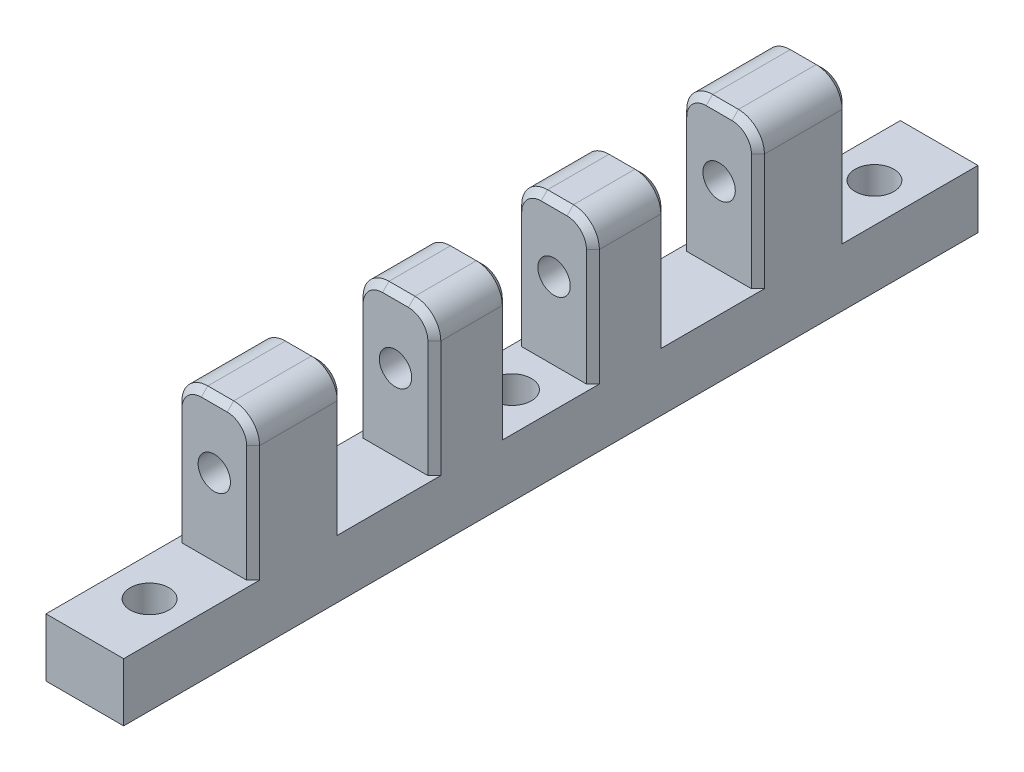
from build123d import *

# Parameters (mm, degrees)
SKETCH_1_W          = 66
SKETCH_1_H          = 4.5
EXTRUDE_1_DEPTH     = 6
SKETCH_2_W          = 5.75
SKETCH_2_H          = 11
SKETCH_2_W_2        = 7
EXTRUDE_2_DEPTH     = 6
SKETCH_3_R          = 1.25
CUT_EXTRUDE_1_DEPTH = 51
SKETCH_4_R          = 1.5
CUT_EXTRUDE_2_DEPTH = 51
FILLET_1_R          = 2
FILLET_2_R          = 2
FILLET_3_R          = 2
FILLET_4_R          = 2
FILLET_5_R          = 2
FILLET_6_R          = 2
FILLET_7_R          = 2
FILLET_8_R          = 2
CHAMFER_1_SIZE      = 0.5
CHAMFER_2_SIZE      = 0.5


with BuildPart() as part:
    # 草图1 → 凸台-拉伸1 (new body)
    with BuildSketch(Plane(origin=(0, 0, 0), x_dir=(0, 0, -1), z_dir=(1, 0, 0))):
        Rectangle(SKETCH_1_W, SKETCH_1_H)
    extrude(amount=EXTRUDE_1_DEPTH)

    # 草图2 → 凸台-拉伸2 (add)
    with BuildSketch(Plane.ZY):
        with Locations((6.125, 7.75)):
            Rectangle(SKETCH_2_W, SKETCH_2_H)
        with Locations((19.5, 7.75)):
            Rectangle(SKETCH_2_W_2, SKETCH_2_H)
        with Locations((-19.5, 7.75)):
            Rectangle(SKETCH_2_W_2, SKETCH_2_H)
        with Locations((-6.125, 7.75)):
            Rectangle(SKETCH_2_W, SKETCH_2_H)
    extrude(amount=-EXTRUDE_2_DEPTH)

    # 草图3 → 切除-拉伸1 (cut)
    with BuildSketch(Plane.XY.offset(23)):
        with Locations((3, 8.182)):
            Circle(SKETCH_3_R)
    extrude(amount=-CUT_EXTRUDE_1_DEPTH, mode=Mode.SUBTRACT)

    # 草图4 → 切除-拉伸2 (cut)
    with BuildSketch(Plane(origin=(0, 2.25, 0), x_dir=(1, 0, 0), z_dir=(0, 1, 0))):
        with Locations(Location((3, 0, 0), (0, 0, 270))):
            Circle(SKETCH_4_R)
        with Locations(Location((3, 28, 0), (0, 0, 270))):
            Circle(SKETCH_4_R)
        with Locations(Location((3, -28, 0), (0, 0, 270))):
            Circle(SKETCH_4_R)
    extrude(amount=-CUT_EXTRUDE_2_DEPTH, mode=Mode.SUBTRACT)

    # 圆角1
    fillet_1_edges = [part.edges().sort_by_distance(p)[0] for p in [
        (6, 13.25, 19.5),
    ]]
    fillet(fillet_1_edges, radius=FILLET_1_R)

    # 圆角2
    fillet_2_edges = [part.edges().sort_by_distance(p)[0] for p in [
        (6, 13.25, -19.5),
    ]]
    fillet(fillet_2_edges, radius=FILLET_2_R)

    # 圆角3
    fillet_3_edges = [part.edges().sort_by_distance(p)[0] for p in [
        (6, 13.25, 6.125),
    ]]
    fillet(fillet_3_edges, radius=FILLET_3_R)

    # 圆角4
    fillet_4_edges = [part.edges().sort_by_distance(p)[0] for p in [
        (6, 13.25, -6.125),
    ]]
    fillet(fillet_4_edges, radius=FILLET_4_R)

    # 圆角5
    fillet_5_edges = [part.edges().sort_by_distance(p)[0] for p in [
        (0, 13.25, -19.5),
    ]]
    fillet(fillet_5_edges, radius=FILLET_5_R)

    # 圆角6
    fillet_6_edges = [part.edges().sort_by_distance(p)[0] for p in [
        (0, 13.25, -6.125),
    ]]
    fillet(fillet_6_edges, radius=FILLET_6_R)

    # 圆角7
    fillet_7_edges = [part.edges().sort_by_distance(p)[0] for p in [
        (0, 13.25, 6.125),
    ]]
    fillet(fillet_7_edges, radius=FILLET_7_R)

    # 圆角8
    fillet_8_edges = [part.edges().sort_by_distance(p)[0] for p in [
        (0, 13.25, 19.5),
    ]]
    fillet(fillet_8_edges, radius=FILLET_8_R)

    # 倒角1
    chamfer_1_edges = [part.edges().sort_by_distance(p)[0] for p in [
        (3, 13.25, -16),
        (5.414213562, 12.664213562, -16),
        (0.585786438, 12.664213562, -16),
        (6, 6.75, -16),
        (0, 6.75, -16),
    ]]
    chamfer(chamfer_1_edges, length=CHAMFER_1_SIZE)

    # 倒角2
    chamfer_2_edges = [part.edges().sort_by_distance(p)[0] for p in [
        (0, 6.75, -23),
        (6, 6.75, -23),
        (0.585786438, 12.664213562, -23),
        (5.414213562, 12.664213562, -23),
        (3, 13.25, -23),
        (0, 6.75, -9),
        (6, 6.75, -9),
        (0.585786438, 12.664213562, -9),
        (5.414213562, 12.664213562, -9),
        (3, 13.25, -9),
        (0, 6.75, 3.25),
        (6, 6.75, 3.25),
        (0.585786438, 12.664213562, 3.25),
        (5.414213562, 12.664213562, 3.25),
        (3, 13.25, 3.25),
        (0, 6.75, 16),
        (6, 6.75, 16),
        (0.585786438, 12.664213562, 16),
        (5.414213562, 12.664213562, 16),
        (3, 13.25, 16),
        (0, 6.75, 23),
        (6, 6.75, 23),
        (0.585786438, 12.664213562, 23),
        (5.414213562, 12.664213562, 23),
        (3, 13.25, 23),
        (0, 6.75, 9),
        (6, 6.75, 9),
        (0.585786438, 12.664213562, 9),
        (5.414213562, 12.664213562, 9),
        (3, 13.25, 9),
        (0, 6.75, -3.25),
        (6, 6.75, -3.25),
        (0.585786438, 12.664213562, -3.25),
        (5.414213562, 12.664213562, -3.25),
        (3, 13.25, -3.25),
    ]]
    chamfer(chamfer_2_edges, length=CHAMFER_2_SIZE)


solid = part.part
